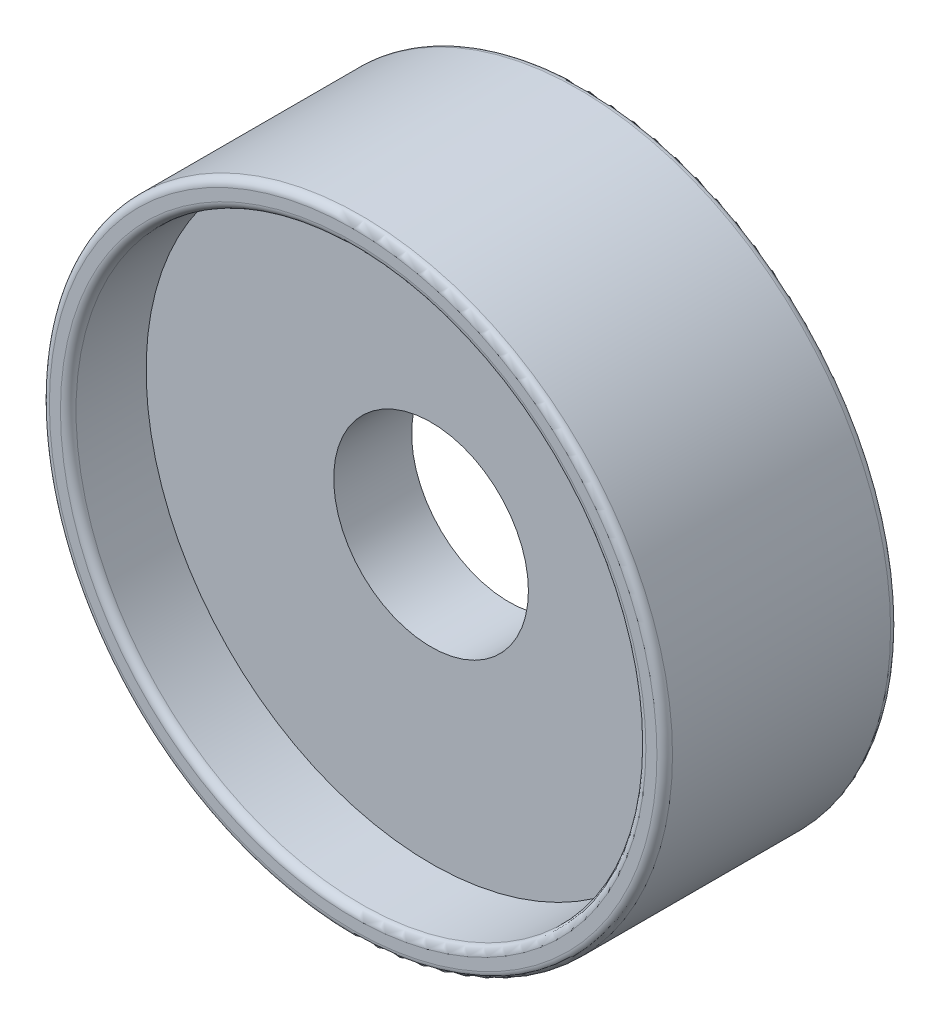
from build123d import *

# Parameters (mm, degrees)
SKETCH1_R           = 101.6
SKETCH1_R_2         = 31.75
BOSS_EXTRUDE1_DEPTH = 38.1
SKETCH2_R           = 92.918511566
CUT_EXTRUDE1_DEPTH  = 25.4
FILLET1_R           = 2.54
FILLET2_R           = 2.54


with BuildPart() as part:
    # Sketch1 → Boss-Extrude1 (new, symmetric)
    with BuildSketch(Plane.XY):
        Circle(SKETCH1_R)
        Circle(SKETCH1_R_2, mode=Mode.SUBTRACT)
    extrude(amount=BOSS_EXTRUDE1_DEPTH, both=True)

    # Sketch2 → Cut-Extrude1 (cut)
    with BuildSketch(Plane.XY.offset(38.1)):
        Circle(SKETCH2_R)
    cut_extrude1 = extrude(amount=-CUT_EXTRUDE1_DEPTH, mode=Mode.SUBTRACT)

    # Mirror1: Cut-Extrude1 across plane
    add(cut_extrude1.mirror(Plane.XY), mode=Mode.SUBTRACT)

    # Fillet1
    fillet1_edges = [part.edges().sort_by_distance(p)[0] for p in [
        (-92.918511566, 0, -38.1),
        (-101.6, 0, -38.1),
    ]]
    fillet(fillet1_edges, radius=FILLET1_R)

    # Fillet2
    fillet2_edges = [part.edges().sort_by_distance(p)[0] for p in [
        (-92.918511566, 0, 38.1),
        (-101.6, 0, 38.1),
    ]]
    fillet(fillet2_edges, radius=FILLET2_R)


solid = part.part
